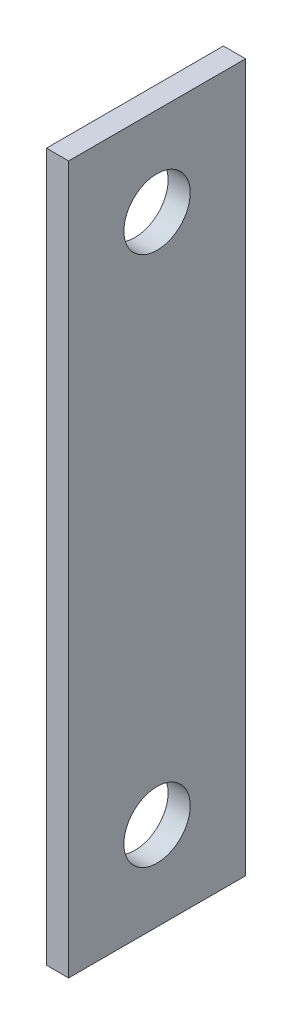
from build123d import *

# Parameters (mm, degrees)
SKETCH1_W           = 25.4
SKETCH1_H           = 101.6
SKETCH1_R           = 4.7625
BOSS_EXTRUDE1_DEPTH = 3.175


with BuildPart() as part:
    # Sketch1 → Boss-Extrude1 (new body)
    with BuildSketch(Plane(origin=(0, 0, 0), x_dir=(0, 0, -1), z_dir=(1, 0, 0))):
        Rectangle(SKETCH1_W, SKETCH1_H)
        with Locations((0, 38.1)):
            Circle(SKETCH1_R, mode=Mode.SUBTRACT)
        with Locations((0, -38.1)):
            Circle(SKETCH1_R, mode=Mode.SUBTRACT)
    extrude(amount=BOSS_EXTRUDE1_DEPTH)


solid = part.part
